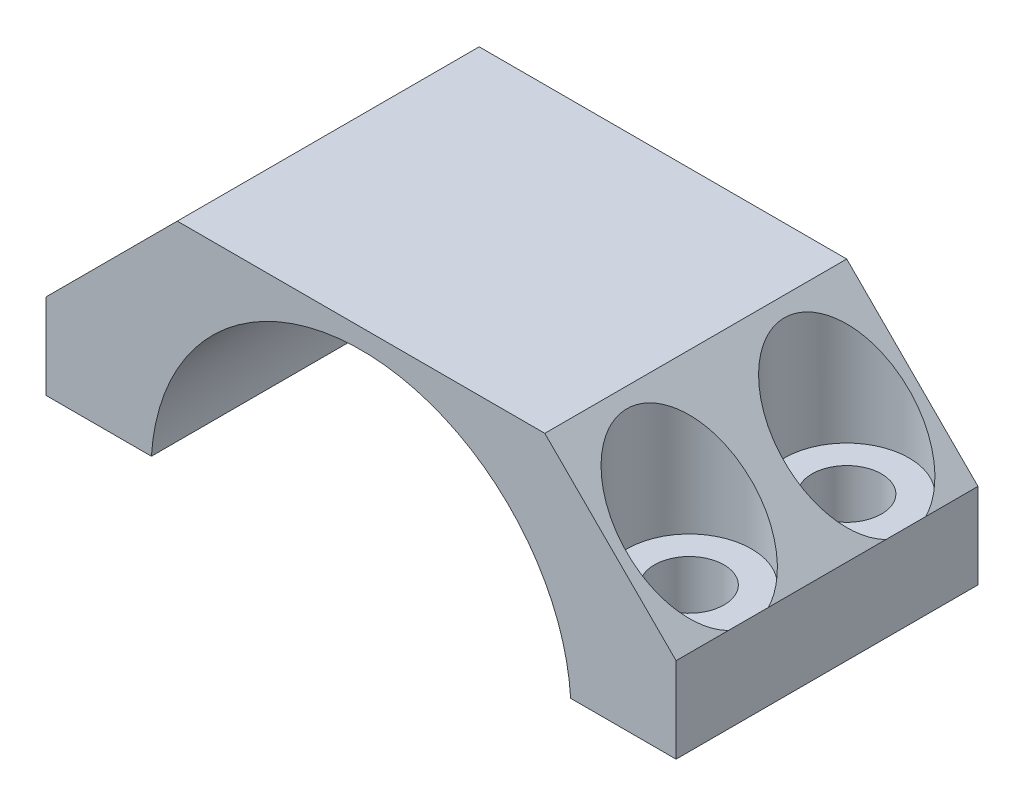
from build123d import *

# Parameters (mm, degrees)
BOSS_EXTRUDE1_DEPTH            = 11.5
CBORE_FOR_M5_SHCS1_D           = 5.3
CBORE_FOR_M5_SHCS1_CBORE_D     = 9.5
CBORE_FOR_M5_SHCS1_CBORE_DEPTH = 10
CHAMFER_2_REACH                = 39.567
SKETCH5_W                      = 48
SKETCH5_H                      = 23
CUT_EXTRUDE2_DEPTH             = 1


with BuildPart() as part:
    # Sketch1 → Boss-Extrude1 (new, symmetric)
    with BuildSketch(Plane.XY):
        with BuildLine():
            Line((24, 17.5), (-24, 17.5))
            Line((-24, 17.5), (-24, 0))
            Line((-24, 0), (-16, 0))
            ThreePointArc((-16, 0), (0, 16), (16, 0))
            Line((16, 0), (24, 0))
            Line((24, 0), (24, 17.5))
        make_face()
    extrude(amount=BOSS_EXTRUDE1_DEPTH, both=True)

    # CBORE for M5 SHCS1 (through all)
    with Locations(Plane(origin=(0, 17.5, 0), x_dir=(1, 0, 0), z_dir=(0, 1, 0))):
        with Locations((-19.5, -6), (-19.5, 6), (19.5, -6), (19.5, 6)):
            CounterBoreHole(CBORE_FOR_M5_SHCS1_D / 2, CBORE_FOR_M5_SHCS1_CBORE_D / 2, CBORE_FOR_M5_SHCS1_CBORE_DEPTH)

    # Sketch4 → Chamfer 2 (cut, up to next)
    with BuildSketch(Plane.XY.offset(11.5), mode=Mode.PRIVATE) as chamfer_2_sk1:
        Polygon((24, 17.5), (14, 17.5), (24, 7.5), align=None)
    chamfer_2_tool1 = extrude(chamfer_2_sk1.sketch, amount=-CHAMFER_2_REACH, mode=Mode.PRIVATE) & part.part
    # Sketch4 → Chamfer 2 (cut, up to next)
    with BuildSketch(Plane.XY.offset(11.5), mode=Mode.PRIVATE) as chamfer_2_sk2:
        Polygon((-14, 17.5), (-24, 17.5), (-24, 7.5), align=None)
    chamfer_2_tool2 = extrude(chamfer_2_sk2.sketch, amount=-CHAMFER_2_REACH, mode=Mode.PRIVATE) & part.part
    add(chamfer_2_tool1.solids().sort_by_distance((20.666667, 14.166667, 11.5))[0], mode=Mode.SUBTRACT)
    add(chamfer_2_tool2.solids().sort_by_distance((-20.666667, 14.166667, 11.5))[0], mode=Mode.SUBTRACT)

    # Sketch5 → Cut-Extrude2 (cut)
    with BuildSketch(Plane(origin=(0, 0, 0), x_dir=(-1, 0, 0), z_dir=(0, -1, 0))):
        Rectangle(SKETCH5_W, SKETCH5_H)
    extrude(amount=-CUT_EXTRUDE2_DEPTH, mode=Mode.SUBTRACT)


solid = part.part
